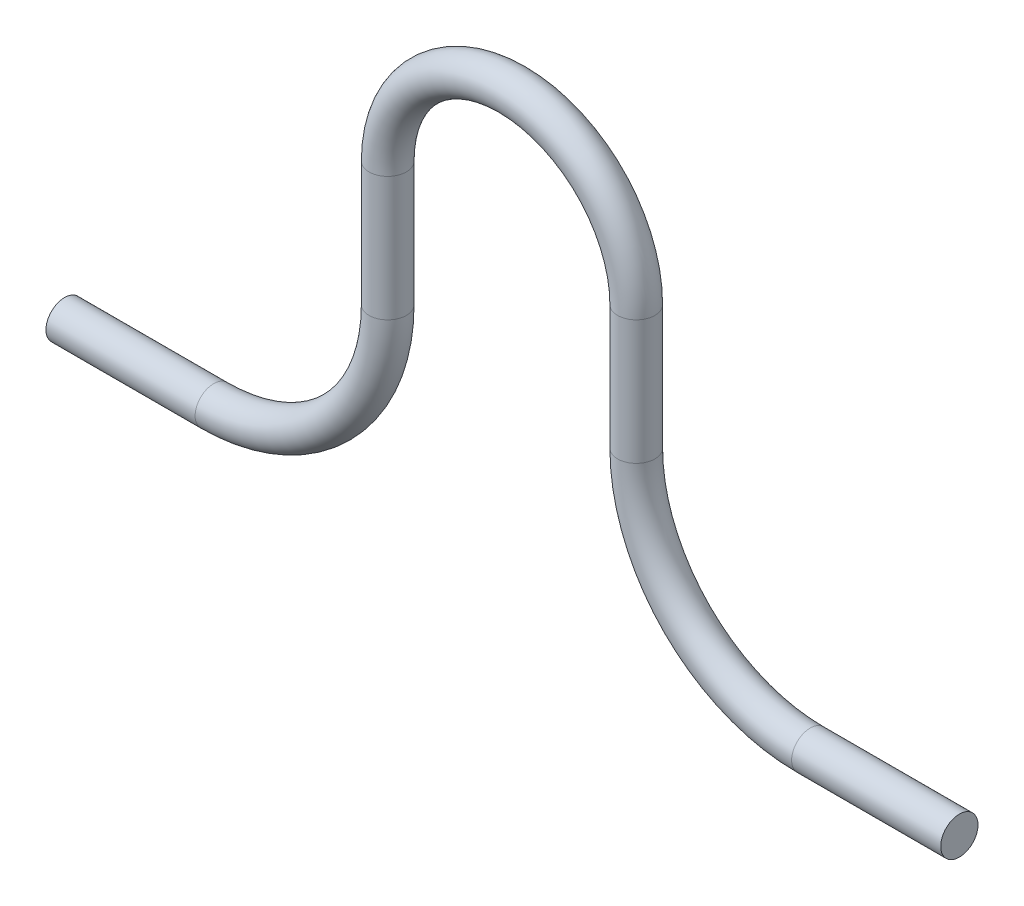
from build123d import *

# Parameters (mm, degrees)
SKETCH_5_R = 7.5


with BuildPart() as part:
    # По траектории3: sweep along a path in Эскиз4
    with BuildLine(Plane.XY) as sweep_3_path:
        Line((-180, -170), (-120, -170))
        ThreePointArc((-120, -170), (-70.502525317, -149.497474683), (-50, -100))
        Line((-50, -100), (-50, -50))
        ThreePointArc((-50, -50), (-35.355339059, -14.644660941), (0, 0))
    # Эскиз5 → По траектории3 (sweep)
    with BuildSketch(Plane(origin=(0, 0, 0), x_dir=(0, 0, -1), z_dir=(1, 0, 0))):
        Circle(SKETCH_5_R)
    sweep_3 = sweep(path=sweep_3_path.line)

    # Зеркальное отражение4: По траектории3 across plane
    add(sweep_3.mirror(Plane(origin=(0, 0, 0), x_dir=(0, 0, 1), z_dir=(1, 0, 0))))


solid = part.part
